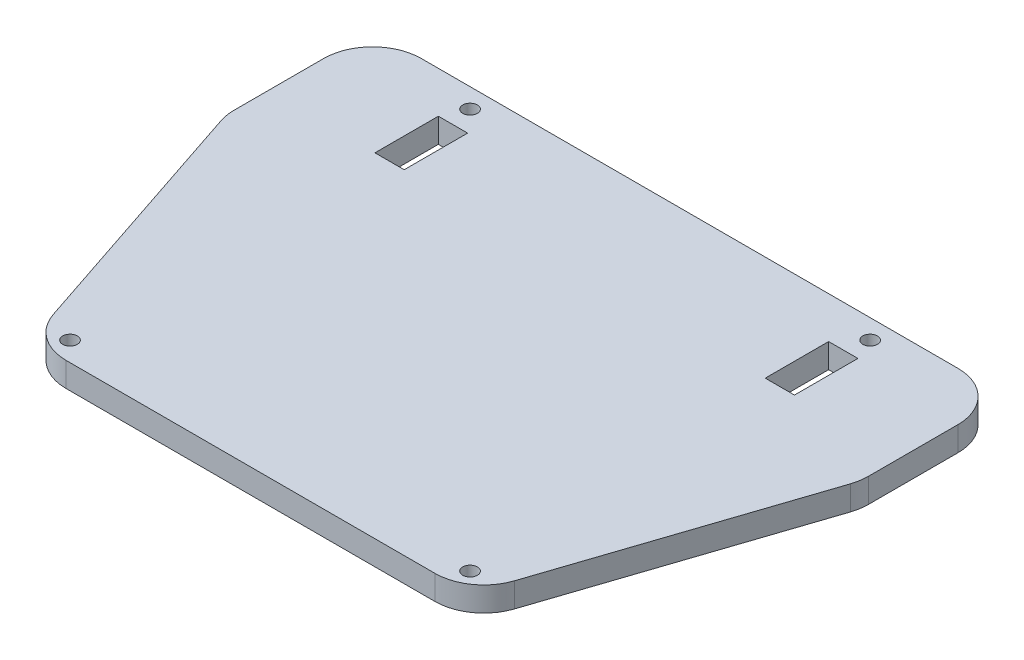
from build123d import *

# Parameters (mm, degrees)
SKETCH1_W           = 90
SKETCH1_H           = 90
SKETCH1_R           = 1.5
SKETCH1_W_2         = 6
SKETCH1_H_2         = 13
BOSS_EXTRUDE9_DEPTH = 5
FILLET2_R           = 10


with BuildPart() as part:
    # Sketch1 → Boss-Extrude9 (new body)
    # profile 1 of 3: a face of its own
    with BuildSketch(Plane(origin=(0, 0, 0), x_dir=(1, 0, 0), z_dir=(0, 1, 0))):
        Polygon((-20, 90), (-20, 60), (0, 0), (0, 90), align=None)
    # profile 2 of 3: a face of its own
    with BuildSketch(Plane(origin=(0, 0, 0), x_dir=(1, 0, 0), z_dir=(0, 1, 0))):
        with Locations((45, 45)):
            Rectangle(SKETCH1_W, SKETCH1_H)
        with Locations(Location((4, 4, 0), (0, 0, 270))):
            Circle(SKETCH1_R, mode=Mode.SUBTRACT)
        with Locations(Location((86, 4, 0), (0, 0, 270))):
            Circle(SKETCH1_R, mode=Mode.SUBTRACT)
        with Locations((5, 75)):
            Rectangle(SKETCH1_W_2, SKETCH1_H_2, mode=Mode.SUBTRACT)
        with Locations(Location((4, 86, 0), (0, 0, 270))):
            Circle(SKETCH1_R, mode=Mode.SUBTRACT)
        with Locations((85, 75)):
            Rectangle(SKETCH1_W_2, SKETCH1_H_2, mode=Mode.SUBTRACT)
        with Locations(Location((86, 86, 0), (0, 0, 270))):
            Circle(SKETCH1_R, mode=Mode.SUBTRACT)
    # profile 3 of 3: a face of its own
    with BuildSketch(Plane(origin=(0, 0, 0), x_dir=(1, 0, 0), z_dir=(0, 1, 0))):
        Polygon((110, 90), (110, 60), (90, 0), (90, 90), align=None)
    extrude(amount=BOSS_EXTRUDE9_DEPTH)

    # Fillet2
    fillet2_edges = [part.edges().sort_by_distance(p)[0] for p in [
        (-20, 2.5, -90),
        (110, 2.5, -90),
        (110, 2.5, -60),
        (90, 2.5, 0),
        (0, 2.5, 0),
        (-20, 2.5, -60),
    ]]
    fillet(fillet2_edges, radius=FILLET2_R)


solid = part.part
